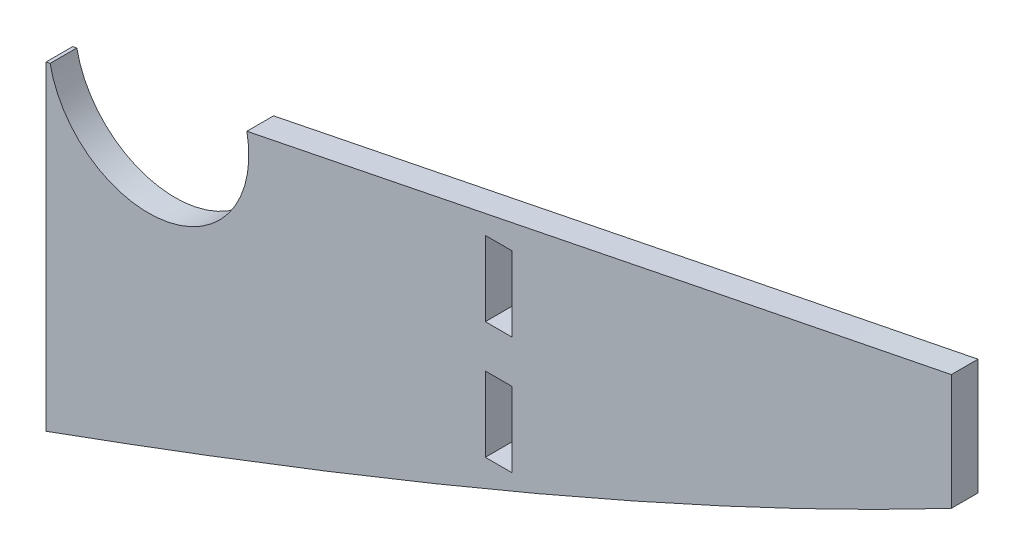
from build123d import *

# Parameters (mm, degrees)
BOSS_EXTRUDE1_DEPTH = 3.175
SKETCH7_W           = 3.175
SKETCH7_H           = 8.89
CUT_EXTRUDE1_DEPTH  = 377.128183046


with BuildPart() as part:
    # Sketch3 → Boss-Extrude1 (new body)
    with BuildSketch(Plane.XY.offset(-652.571489798)):
        with BuildLine():
            Line((267.190410107, 14.374698747), (266.97653556, 14.331680124))
            Line((266.97653556, 14.331680124), (266.7, 14.276057895))
            Line((266.7, 14.276057895), (266.7, -23.769261632))
            add(Edge.make_bspline(
                [(266.7, -23.769261632), (275.880532182, -20.443051724), (285.029484636, -17.032239756), (303.244718304, -9.989758223), (312.307576038, -6.359638962), (330.31528392, 1.18765824), (339.262942891, 5.105981061), (356.976752757, 13.311628375), (365.744943517, 17.599570981), (374.396, 22.131936474)],
                knots=[0, 0, 0, 0, 0.25, 0.25, 0.5, 0.5, 0.75, 0.75, 1, 1, 1, 1], degree=3))
            Line((374.396, 22.131936474), (374.396, 35.91607659))
            add(Edge.make_bspline(
                [(374.396, 35.91607659), (360.350473035, 33.13205344), (346.312147582, 30.312088758), (318.38150515, 24.690232007), (304.489443265, 21.887076072), (290.596661876, 19.087501725)],
                knots=[0, 0, 0, 0, 0.5, 0.5, 0.994876875, 0.994876875, 0.994876875, 0.994876875], degree=3))
            ThreePointArc((290.596661876, 19.087501725), (290.771522244, 17.918896248), (290.83, 16.738728775))
            ThreePointArc((290.83, 16.738728775), (280.079910741, 4.859978333), (267.190410107, 14.374698747))
        make_face()
    extrude(amount=BOSS_EXTRUDE1_DEPTH)

    # Sketch7 → Cut-Extrude1 (cut, through all)
    with BuildSketch(Plane.XY.offset(-649.396489798)):
        with Locations((320.548, 18.094665768)):
            Rectangle(SKETCH7_W, SKETCH7_H)
        with Locations((320.548, 4.124665768)):
            Rectangle(SKETCH7_W, SKETCH7_H)
    extrude(amount=-CUT_EXTRUDE1_DEPTH, mode=Mode.SUBTRACT)


solid = part.part
